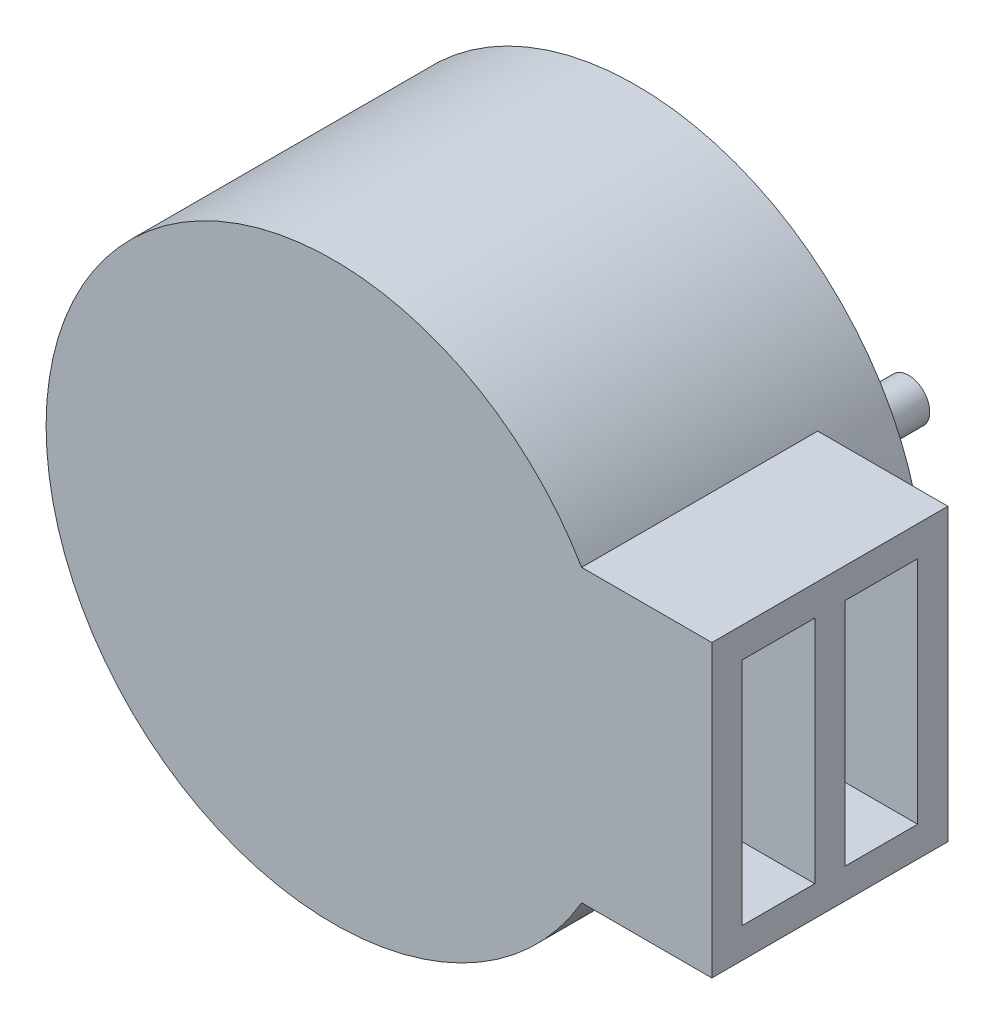
from build123d import *

# Parameters (mm, degrees)
BOSS_EXTRUDE1_DEPTH = 5
CUT_EXTRUDE1_DEPTH  = 1.1
SKETCH3_W           = 1.2
SKETCH3_H           = 3.8
CUT_EXTRUDE2_DEPTH  = 4
SKETCH4_R           = 0.35
BOSS_EXTRUDE2_DEPTH = 2.5


with BuildPart() as part:
    # Sketch1 → Boss-Extrude1 (new body)
    with BuildSketch(Plane.XY):
        with BuildLine():
            Line((4.099085264, 2.4), (6.25, 2.4))
            Line((6.25, 2.4), (6.25, -2.4))
            Line((6.25, -2.4), (4.099085264, -2.4))
            ThreePointArc((4.099085264, -2.4), (-4.75, 0), (4.099085264, 2.4))
        make_face()
    extrude(amount=BOSS_EXTRUDE1_DEPTH)

    # Sketch2 → Cut-Extrude1 (cut)
    with BuildSketch(Plane(origin=(0, 0, 0), x_dir=(-1, 0, 0), z_dir=(0, 0, -1))):
        with BuildLine():
            Line((-4.099085264, -2.4), (-6.25, -2.4))
            Line((-6.25, -2.4), (-6.25, 2.4))
            Line((-6.25, 2.4), (-4.099085264, 2.4))
            ThreePointArc((-4.099085264, 2.4), (-4.75, 0), (-4.099085264, -2.4))
        make_face()
    extrude(amount=-CUT_EXTRUDE1_DEPTH, mode=Mode.SUBTRACT)

    # Sketch3 → Cut-Extrude2 (cut)
    with BuildSketch(Plane(origin=(6.25, 0, 0), x_dir=(0, 0, -1), z_dir=(1, 0, 0))):
        with Locations((-3.9, 0)):
            Rectangle(SKETCH3_W, SKETCH3_H)
        with Locations((-2.2, 0)):
            Rectangle(SKETCH3_W, SKETCH3_H)
    extrude(amount=-CUT_EXTRUDE2_DEPTH, mode=Mode.SUBTRACT)

    # Sketch4 → Boss-Extrude2 (add)
    with BuildSketch(Plane(origin=(0, 0, 0), x_dir=(-1, 0, 0), z_dir=(0, 0, -1))):
        with Locations((-2, 0)):
            Circle(SKETCH4_R)
        with Locations(Location((2, 0, 0), (0, 0, 180))):
            Circle(SKETCH4_R)
    extrude(amount=BOSS_EXTRUDE2_DEPTH)


solid = part.part
